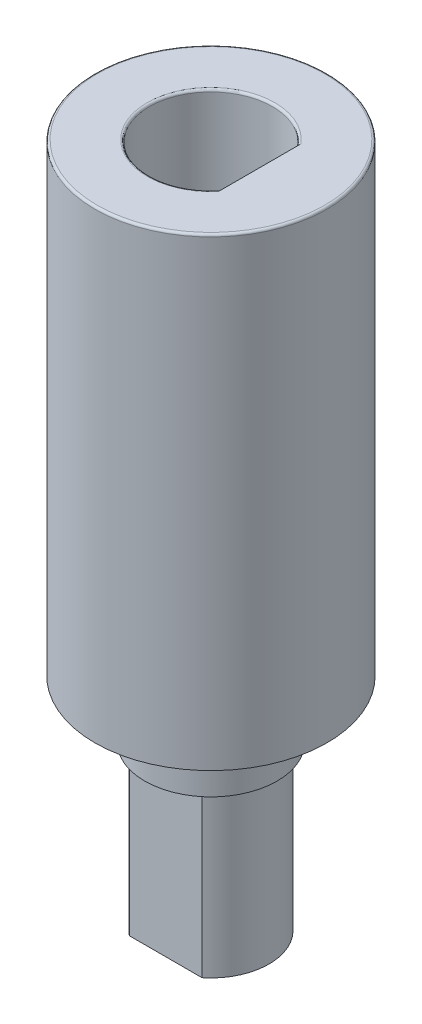
from build123d import *

# Parameters (mm, degrees)
SKETCH2_R           = 5
BOSS_EXTRUDE1_DEPTH = 20
CUT_EXTRUDE3_DEPTH  = 15
BOSS_EXTRUDE2_DEPTH = 9.5
SKETCH6_R           = 2.85
BOSS_EXTRUDE3_DEPTH = 2.5
FILLET3_R           = 0.1


with BuildPart() as part:
    # Sketch2 → Boss-Extrude1 (new body)
    with BuildSketch(Plane(origin=(0, 0, 0), x_dir=(1, 0, 0), z_dir=(0, 1, 0))):
        with Locations(Location((0, 0, 0), (0, 0, 270))):
            Circle(SKETCH2_R)
    extrude(amount=BOSS_EXTRUDE1_DEPTH)

    # Sketch3 → Cut-Extrude3 (cut)
    with BuildSketch(Plane(origin=(0, 20, 0), x_dir=(1, 0, 0), z_dir=(0, 1, 0))):
        with BuildLine():
            Line((2.1, 1.616322988), (2.1, -1.616322988))
            ThreePointArc((2.1, -1.616322988), (-2.65, 0), (2.1, 1.616322988))
        make_face()
    extrude(amount=-CUT_EXTRUDE3_DEPTH, mode=Mode.SUBTRACT)

    # Sketch4 → Boss-Extrude2 (add)
    with BuildSketch(Plane(origin=(0, 0, 0), x_dir=(-1, 0, 0), z_dir=(0, -1, 0))):
        with BuildLine():
            Line((1.564448785, 1.95), (-1.564448785, 1.95))
            ThreePointArc((-1.564448785, 1.95), (-2.5, 0), (-1.564448785, -1.95))
            Line((-1.564448785, -1.95), (1.564448785, -1.95))
            ThreePointArc((1.564448785, -1.95), (2.5, 0), (1.564448785, 1.95))
        make_face()
    extrude(amount=BOSS_EXTRUDE2_DEPTH)

    # Sketch6 → Boss-Extrude3 (add)
    with BuildSketch(Plane.XZ):
        with Locations(Location((0, 0, 0), (0, 0, 90))):
            Circle(SKETCH6_R)
    extrude(amount=BOSS_EXTRUDE3_DEPTH)

    # Fillet3
    fillet3_edges = [part.edges().sort_by_distance(p)[0] for p in [
        (0, 20, -5),
        (-2.65, 20, 0),
    ]]
    fillet(fillet3_edges, radius=FILLET3_R)


solid = part.part
